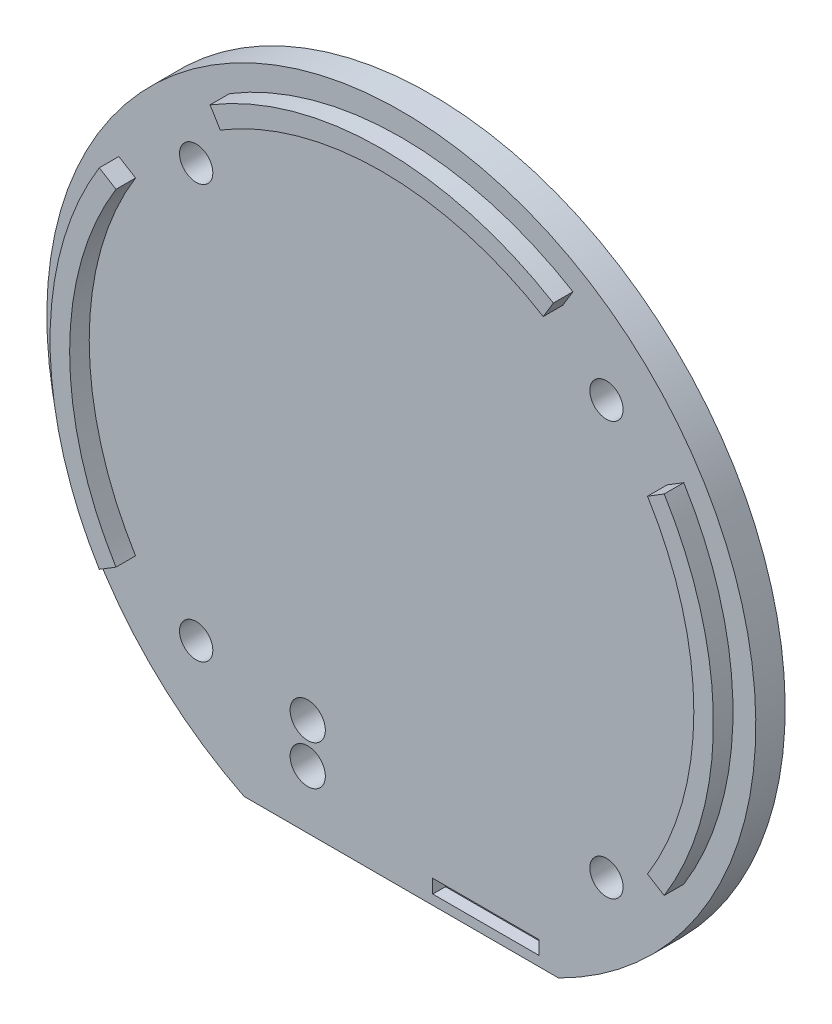
from build123d import *

# Parameters (mm, degrees)
BOSS_EXTRUDE1_DEPTH = 3
SKETCH2_R           = 1.7
CUT_EXTRUDE1_DEPTH  = 3
BOSS_EXTRUDE2_DEPTH = 2
SKETCH6_R           = 1.8
CUT_EXTRUDE2_DEPTH  = 3
SKETCH8_W           = 10.85
SKETCH8_H           = 1.4
CUT_EXTRUDE4_DEPTH  = 1.3


with BuildPart() as part:
    # Sketch1 → Boss-Extrude1 (new body)
    with BuildSketch(Plane.XY):
        with BuildLine():
            Line((-16.06, -32.453666973), (16.06, -32.453666973))
            ThreePointArc((16.06, -32.453666973), (0, 36.21), (-16.06, -32.453666973))
        make_face()
    extrude(amount=BOSS_EXTRUDE1_DEPTH)

    # Sketch2 → Cut-Extrude1 (cut)
    with BuildSketch(Plane.XY.offset(3)):
        with Locations((-20.955, 21.12)):
            Circle(SKETCH2_R)
        with Locations((20.955, 21.12)):
            Circle(SKETCH2_R)
        with Locations((-20.955, -21.12)):
            Circle(SKETCH2_R)
        with Locations((20.955, -21.12)):
            Circle(SKETCH2_R)
    extrude(amount=-CUT_EXTRUDE1_DEPTH, mode=Mode.SUBTRACT)

    # Sketch4 → Boss-Extrude2 (add)
    with BuildSketch(Plane.XY.offset(3)):
        with BuildLine():
            Line((-17.534144761, 28.989794195), (-16.499071281, 27.278472224))
            ThreePointArc((-16.499071281, 27.278472224), (0, 31.88), (16.499071281, 27.278472224))
            Line((16.499071281, 27.278472224), (17.534144761, 28.989794195))
            ThreePointArc((17.534144761, 28.989794195), (0, 33.88), (-17.534144761, 28.989794195))
        make_face()
        with BuildLine():
            Line((-28.851381969, 17.760972903), (-27.148230731, 16.712509332))
            ThreePointArc((-27.148230731, 16.712509332), (-31.88, 0), (-27.148230731, -16.712509332))
            Line((-27.148230731, -16.712509332), (-28.851381969, -17.760972903))
            ThreePointArc((-28.851381969, -17.760972903), (-33.88, 0), (-28.851381969, 17.760972903))
        make_face()
        with BuildLine():
            Line((28.851381969, 17.760972903), (27.148230731, 16.712509332))
            ThreePointArc((27.148230731, 16.712509332), (31.88, 0), (27.148230731, -16.712509332))
            Line((27.148230731, -16.712509332), (28.851381969, -17.760972903))
            ThreePointArc((28.851381969, -17.760972903), (33.88, 0), (28.851381969, 17.760972903))
        make_face()
    extrude(amount=BOSS_EXTRUDE2_DEPTH)

    # Sketch6 → Cut-Extrude2 (cut)
    with BuildSketch(Plane(origin=(0, 0, 0), x_dir=(-1, 0, 0), z_dir=(0, 0, -1))):
        with Locations((9.56, -22.453666973)):
            Circle(SKETCH6_R)
        with Locations((9.56, -26.523666973)):
            Circle(SKETCH6_R)
    extrude(amount=-CUT_EXTRUDE2_DEPTH, mode=Mode.SUBTRACT)

    # Sketch8 → Cut-Extrude4 (cut)
    with BuildSketch(Plane.XY.offset(3)):
        with Locations((8.635, -30.753666973)):
            Rectangle(SKETCH8_W, SKETCH8_H)
    extrude(amount=-CUT_EXTRUDE4_DEPTH, mode=Mode.SUBTRACT)


solid = part.part
